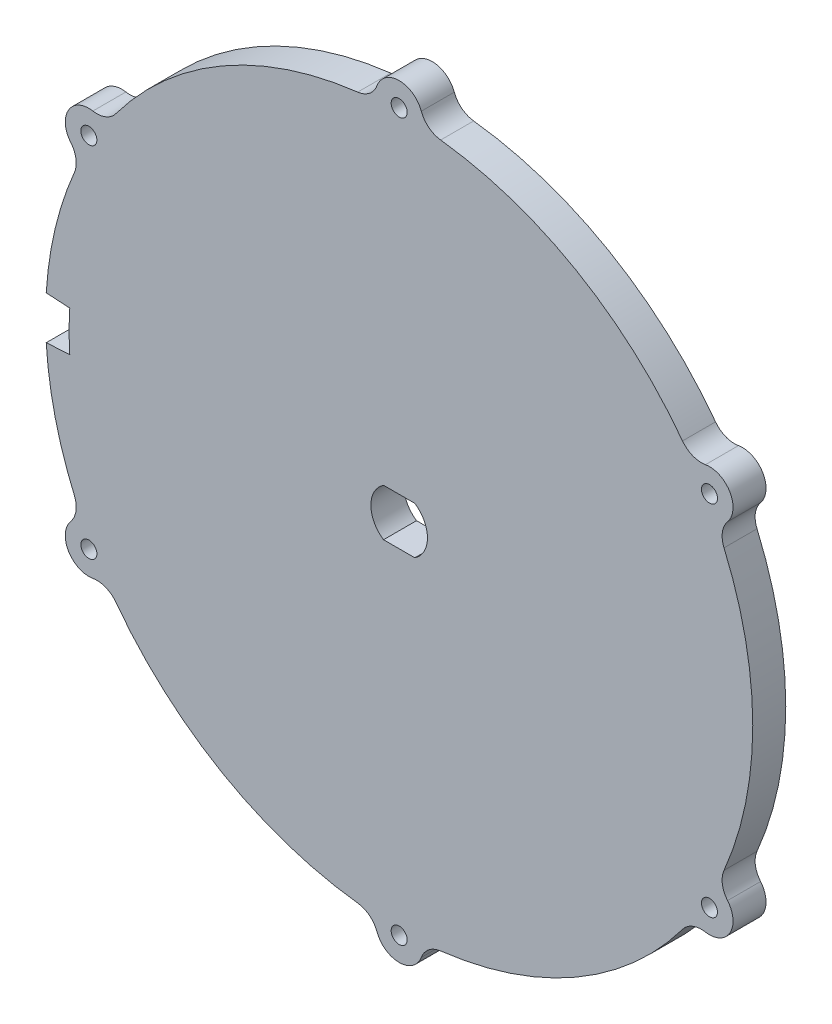
from build123d import *

# Parameters (mm, degrees)
SKETCH2_R                = 75
SKETCH2_R_2              = 6
BOSS_EXTRUDE1_DEPTH      = 3.5
BOSS_EXTRUDE3_START      = 7
BOSS_EXTRUDE3_DEPTH      = 7
FILLET1_R                = 5
SKETCH6_R                = 1.7
CUT_EXTRUDE1_DEPTH       = 111.611934404
CIRPATTERN1_COUNT        = 6
FILLET1_OF_CIRPATTERN1_R = 5
CUT_EXTRUDE2_DEPTH       = 2
SKETCH9_W                = 5
SKETCH9_H                = 7
CUT_REVOLVE1_ANGLE       = 7


with BuildPart() as part:
    # Sketch2 → Boss-Extrude1 (new, symmetric)
    # profile 1 of 3: a face of its own
    with BuildSketch(Plane.XY):
        Circle(SKETCH2_R)
        Circle(SKETCH2_R_2, mode=Mode.SUBTRACT)
    # profile 2 of 3: a face of its own
    with BuildSketch(Plane.XY):
        with BuildLine():
            Line((-3.31662479, 5), (3.31662479, 5))
            ThreePointArc((3.31662479, 5), (0, 6), (-3.31662479, 5))
        make_face()
    # profile 3 of 3: a face of its own
    with BuildSketch(Plane.XY):
        with BuildLine():
            Line((3.31662479, -5), (-3.31662479, -5))
            ThreePointArc((-3.31662479, -5), (0, -6), (3.31662479, -5))
        make_face()
    extrude(amount=BOSS_EXTRUDE1_DEPTH, both=True)

    # Sketch4 → Boss-Extrude3 (add)
    with BuildSketch(Plane.XY.offset(-3.5).offset(BOSS_EXTRUDE3_START)):
        with BuildLine():
            Line((5, 74.833147735), (5, 76))
            ThreePointArc((5, 76), (0, 81), (-5, 76))
            Line((-5, 76), (-5, 74.833147735))
            ThreePointArc((-5, 74.833147735), (0, 75), (5, 74.833147735))
        make_face()
    boss_extrude3 = extrude(amount=-BOSS_EXTRUDE3_DEPTH)

    # Fillet1
    fillet1_edges = [part.edges().sort_by_distance(p)[0] for p in [
        (-5, 74.833147735, 0),
        (5, 74.833147735, 0),
    ]]
    fillet(fillet1_edges, radius=FILLET1_R)

    # Sketch6 → Cut-Extrude1 (cut, through all)
    with BuildSketch(Plane(origin=(0, 0, -3.5), x_dir=(-1, 0, 0), z_dir=(0, 0, -1))):
        with Locations((0, 76)):
            Circle(SKETCH6_R)
    cut_extrude1 = extrude(amount=-CUT_EXTRUDE1_DEPTH, mode=Mode.SUBTRACT)

    # CirPattern1: Boss-Extrude3, Cut-Extrude1 ×6 about axis
    cirpattern1_axis = Axis((0, 0, 0), (0, 0, 1))
    add([boss_extrude3.rotate(cirpattern1_axis, i * 360 / CIRPATTERN1_COUNT) for i in range(1, CIRPATTERN1_COUNT)])
    add([cut_extrude1.rotate(cirpattern1_axis, i * 360 / CIRPATTERN1_COUNT) for i in range(1, CIRPATTERN1_COUNT)], mode=Mode.SUBTRACT)

    # Fillet1 of CirPattern1
    fillet1_of_cirpattern1_edges = [part.edges().sort_by_distance(p)[0] for p in [
        (-67.307406984, 33.086446849, 0),
        (-62.307406984, 41.746700887, 0),
        (-62.307406984, -41.746700887, 0),
        (-67.307406984, -33.086446849, 0),
        (5, -74.833147735, 0),
        (-5, -74.833147735, 0),
        (67.307406984, -33.086446849, 0),
        (62.307406984, -41.746700887, 0),
        (62.307406984, 41.746700887, 0),
        (67.307406984, 33.086446849, 0),
    ]]
    fillet(fillet1_of_cirpattern1_edges, radius=FILLET1_OF_CIRPATTERN1_R)

    # Sketch7 → Cut-Extrude2 (cut)
    with BuildSketch(Plane(origin=(0, 0, -3.5), x_dir=(-1, 0, 0), z_dir=(0, 0, -1))):
        with BuildLine():
            Line((-5, 59.160797831), (-5, 22.912878475))
            ThreePointArc((-5, 22.912878475), (-5.816699867, 20.174265687), (-8, 18.33030278))
            ThreePointArc((-8, 18.33030278), (-10, 17.320508076), (-11.874507866, 16.09335462))
            ThreePointArc((-11.874507866, 16.09335462), (-14.563076654, 15.124542695), (-17.343134833, 15.786566256))
            Line((-17.343134833, 15.786566256), (-48.73475383, 33.910525934))
            ThreePointArc((-48.73475383, 33.910525934), (-51.15568603, 37.354974521), (-50.087649982, 41.427374033))
            ThreePointArc((-50.087649982, 41.427374033), (-32.5, 56.291651246), (-10.833333333, 64.090864317))
            ThreePointArc((-10.833333333, 64.090864317), (-6.772513878, 62.97961091), (-5, 59.160797831))
        make_face()
        with BuildLine():
            Line((5, 59.160797831), (5, 22.912878475))
            ThreePointArc((5, 22.912878475), (5.816699867, 20.174265687), (8, 18.33030278))
            ThreePointArc((8, 18.33030278), (10, 17.320508076), (11.874507866, 16.09335462))
            ThreePointArc((11.874507866, 16.09335462), (14.563076654, 15.124542695), (17.343134833, 15.786566256))
            Line((17.343134833, 15.786566256), (48.73475383, 33.910525934))
            ThreePointArc((48.73475383, 33.910525934), (51.15568603, 37.354974521), (50.087649982, 41.427374033))
            ThreePointArc((50.087649982, 41.427374033), (32.5, 56.291651246), (10.833333333, 64.090864317))
            ThreePointArc((10.833333333, 64.090864317), (6.772513878, 62.97961091), (5, 59.160797831))
        make_face()
        with BuildLine():
            Line((53.73475383, 25.250271897), (22.343134833, 7.126312218))
            ThreePointArc((22.343134833, 7.126312218), (20.379776522, 5.049722992), (19.874507866, 2.23694816))
            ThreePointArc((19.874507866, 2.23694816), (20, 0), (19.874507866, -2.23694816))
            ThreePointArc((19.874507866, -2.23694816), (20.379776522, -5.049722992), (22.343134833, -7.126312218))
            Line((22.343134833, -7.126312218), (53.73475383, -25.250271897))
            ThreePointArc((53.73475383, -25.250271897), (57.928199908, -25.624636389), (60.920983316, -22.663490284))
            ThreePointArc((60.920983316, -22.663490284), (65, 0), (60.920983316, 22.663490284))
            ThreePointArc((60.920983316, 22.663490284), (57.928199908, 25.624636389), (53.73475383, 25.250271897))
        make_face()
        with BuildLine():
            Line((48.73475383, -33.910525934), (17.343134833, -15.786566256))
            ThreePointArc((17.343134833, -15.786566256), (14.563076654, -15.124542695), (11.874507866, -16.09335462))
            ThreePointArc((11.874507866, -16.09335462), (10, -17.320508076), (8, -18.33030278))
            ThreePointArc((8, -18.33030278), (5.816699867, -20.174265687), (5, -22.912878475))
            Line((5, -22.912878475), (5, -59.160797831))
            ThreePointArc((5, -59.160797831), (6.772513878, -62.97961091), (10.833333333, -64.090864317))
            ThreePointArc((10.833333333, -64.090864317), (32.5, -56.291651246), (50.087649982, -41.427374033))
            ThreePointArc((50.087649982, -41.427374033), (51.15568603, -37.354974521), (48.73475383, -33.910525934))
        make_face()
        with BuildLine():
            Line((-5, -59.160797831), (-5, -22.912878475))
            ThreePointArc((-5, -22.912878475), (-5.816699867, -20.174265687), (-8, -18.33030278))
            ThreePointArc((-8, -18.33030278), (-10, -17.320508076), (-11.874507866, -16.09335462))
            ThreePointArc((-11.874507866, -16.09335462), (-14.563076654, -15.124542695), (-17.343134833, -15.786566256))
            Line((-17.343134833, -15.786566256), (-48.73475383, -33.910525934))
            ThreePointArc((-48.73475383, -33.910525934), (-51.15568603, -37.354974521), (-50.087649982, -41.427374033))
            ThreePointArc((-50.087649982, -41.427374033), (-32.5, -56.291651246), (-10.833333333, -64.090864317))
            ThreePointArc((-10.833333333, -64.090864317), (-6.772513878, -62.97961091), (-5, -59.160797831))
        make_face()
        with BuildLine():
            Line((-53.73475383, -25.250271897), (-22.343134833, -7.126312218))
            ThreePointArc((-22.343134833, -7.126312218), (-20.379776522, -5.049722992), (-19.874507866, -2.23694816))
            ThreePointArc((-19.874507866, -2.23694816), (-20, 0), (-19.874507866, 2.23694816))
            ThreePointArc((-19.874507866, 2.23694816), (-20.379776522, 5.049722992), (-22.343134833, 7.126312218))
            Line((-22.343134833, 7.126312218), (-53.73475383, 25.250271897))
            ThreePointArc((-53.73475383, 25.250271897), (-57.928199908, 25.624636389), (-60.920983316, 22.663490284))
            ThreePointArc((-60.920983316, 22.663490284), (-65, 0), (-60.920983316, -22.663490284))
            ThreePointArc((-60.920983316, -22.663490284), (-57.928199908, -25.624636389), (-53.73475383, -25.250271897))
        make_face()
    extrude(amount=-CUT_EXTRUDE2_DEPTH, mode=Mode.SUBTRACT)

    # Sketch9 → Cut-Revolve1 (revolve, symmetric, cut)
    with BuildSketch(Plane(origin=(0, 0, 0), x_dir=(1, 0, 0), z_dir=(0, 1, 0))) as cut_revolve1_sk:
        with Locations((-72.5, 0)):
            Rectangle(SKETCH9_W, SKETCH9_H)
    revolve(axis=Axis((0, 0, 0), (0, 0, -1)), revolution_arc=CUT_REVOLVE1_ANGLE / 2, mode=Mode.SUBTRACT)
    revolve(cut_revolve1_sk.sketch, axis=Axis((0, 0, 0), (0, 0, 1)), revolution_arc=CUT_REVOLVE1_ANGLE / 2, mode=Mode.SUBTRACT)


solid = part.part
